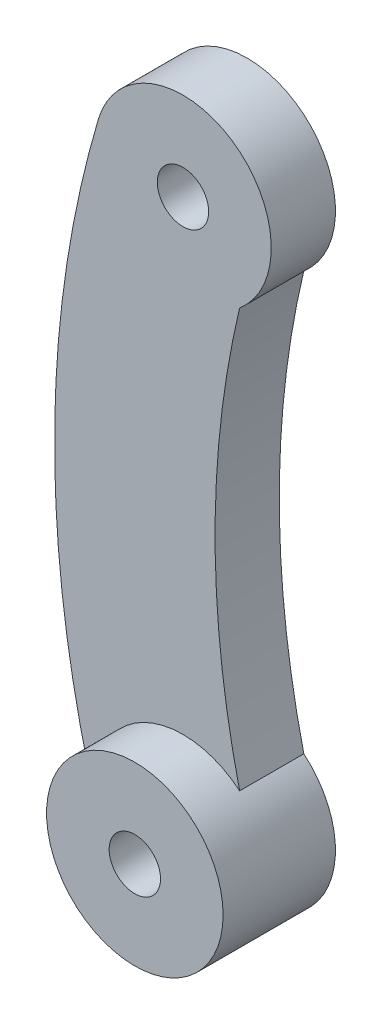
from build123d import *

# Parameters (mm, degrees)
IZIM1_R                     = 1.6
Y_KSEKLIK_EKSTR_ZYON1_DEPTH = 4
IZIM2_R                     = 5.5
IZIM2_R_2                   = 1.6
Y_KSEKLIK_EKSTR_ZYON2_DEPTH = 3


with BuildPart() as part:
    # Çizim1 → Yükseklik-Ekstrüzyon1 (new body)
    with BuildSketch(Plane.XY):
        with BuildLine():
            ThreePointArc((-5.273709113, -1.561407118), (3.018112795, -4.597933792), (3.530207231, 4.2175392))
            ThreePointArc((3.530207231, 4.2175392), (2, 17.25), (3.530207231, 30.2824608))
            ThreePointArc((3.530207231, 30.2824608), (3.018112795, 39.097933792), (-5.273709113, 36.061407118))
            ThreePointArc((-5.273709113, 36.061407118), (-8, 17.25), (-5.273709113, -1.561407118))
        make_face()
        with Locations((0, 34.5)):
            Circle(IZIM1_R, mode=Mode.SUBTRACT)
        Circle(IZIM1_R, mode=Mode.SUBTRACT)
    extrude(amount=Y_KSEKLIK_EKSTR_ZYON1_DEPTH)

    # Çizim2 → Yükseklik-Ekstrüzyon2 (add)
    with BuildSketch(Plane.XY.offset(4)):
        with Locations(Location((0, 0, 0), (0, 0, 196.492641629))):
            Circle(IZIM2_R)
        Circle(IZIM2_R_2, mode=Mode.SUBTRACT)
    extrude(amount=Y_KSEKLIK_EKSTR_ZYON2_DEPTH)


solid = part.part
